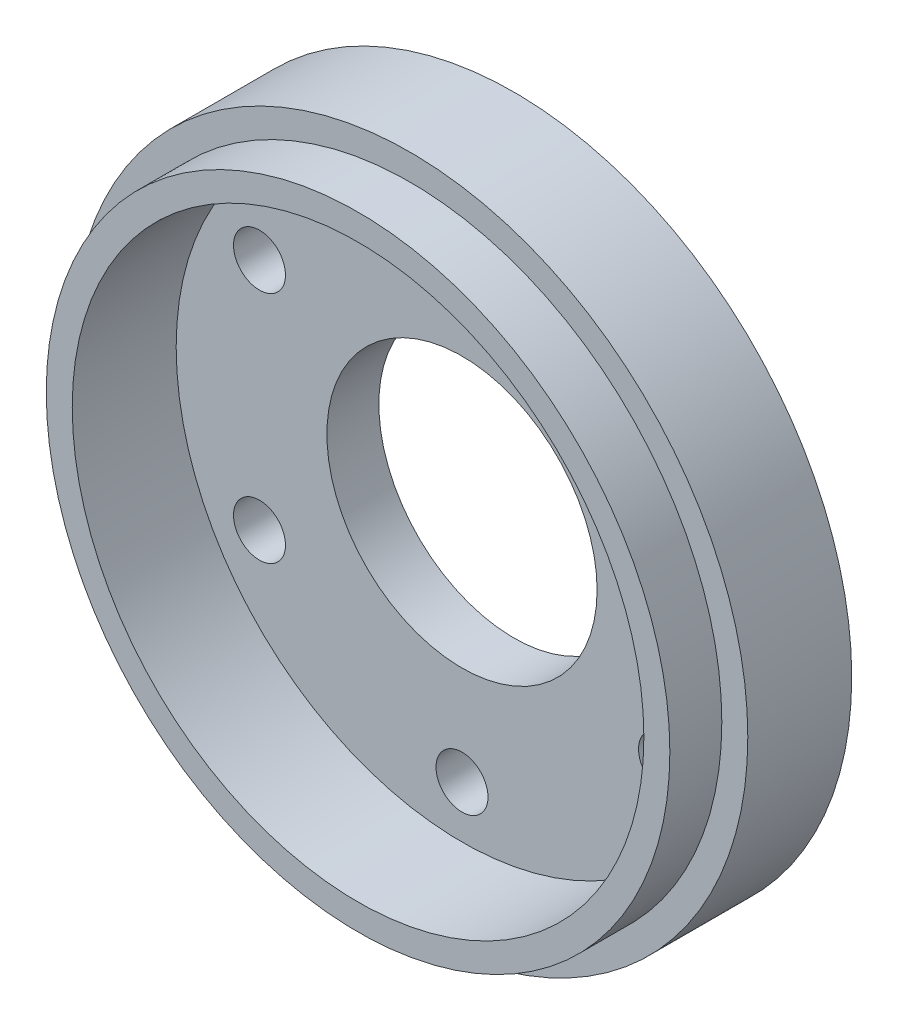
from build123d import *

# Parameters (mm, degrees)
SKETCH_1_R          = 32.5
SKETCH_1_R_2        = 13
EXTRUDE_1_DEPTH     = 5
SKETCH_2_R          = 32.5
SKETCH_2_R_2        = 27.5
EXTRUDE_2_DEPTH     = 5
SKETCH_3_R          = 2.5
CUT_EXTRUDE_1_DEPTH = 47.233105022
SKETCH_4_R          = 30
SKETCH_4_R_2        = 27.5
EXTRUDE_3_DEPTH     = 5


with BuildPart() as part:
    # 草图1 → 凸台-拉伸1 (new body)
    with BuildSketch(Plane.XY):
        Circle(SKETCH_1_R)
        Circle(SKETCH_1_R_2, mode=Mode.SUBTRACT)
    extrude(amount=EXTRUDE_1_DEPTH)

    # 草图2 → 凸台-拉伸2 (add)
    with BuildSketch(Plane.XY.offset(5)):
        Circle(SKETCH_2_R)
        Circle(SKETCH_2_R_2, mode=Mode.SUBTRACT)
    extrude(amount=EXTRUDE_2_DEPTH)

    # 草图3 → 切除-拉伸1 (cut, through all)
    with BuildSketch(Plane.XY.offset(5)):
        with Locations((0, 22.5)):
            Circle(SKETCH_3_R)
        with Locations((19.485571585, 11.25)):
            Circle(SKETCH_3_R)
        with Locations((19.485571585, -11.25)):
            Circle(SKETCH_3_R)
        with Locations((0, -22.5)):
            Circle(SKETCH_3_R)
        with Locations((-19.485571585, -11.25)):
            Circle(SKETCH_3_R)
        with Locations((-19.485571585, 11.25)):
            Circle(SKETCH_3_R)
    extrude(amount=-CUT_EXTRUDE_1_DEPTH, mode=Mode.SUBTRACT)

    # 草图4 → 凸台-拉伸3 (add)
    with BuildSketch(Plane.XY.offset(10)):
        Circle(SKETCH_4_R)
        Circle(SKETCH_4_R_2, mode=Mode.SUBTRACT)
    extrude(amount=EXTRUDE_3_DEPTH)


solid = part.part
